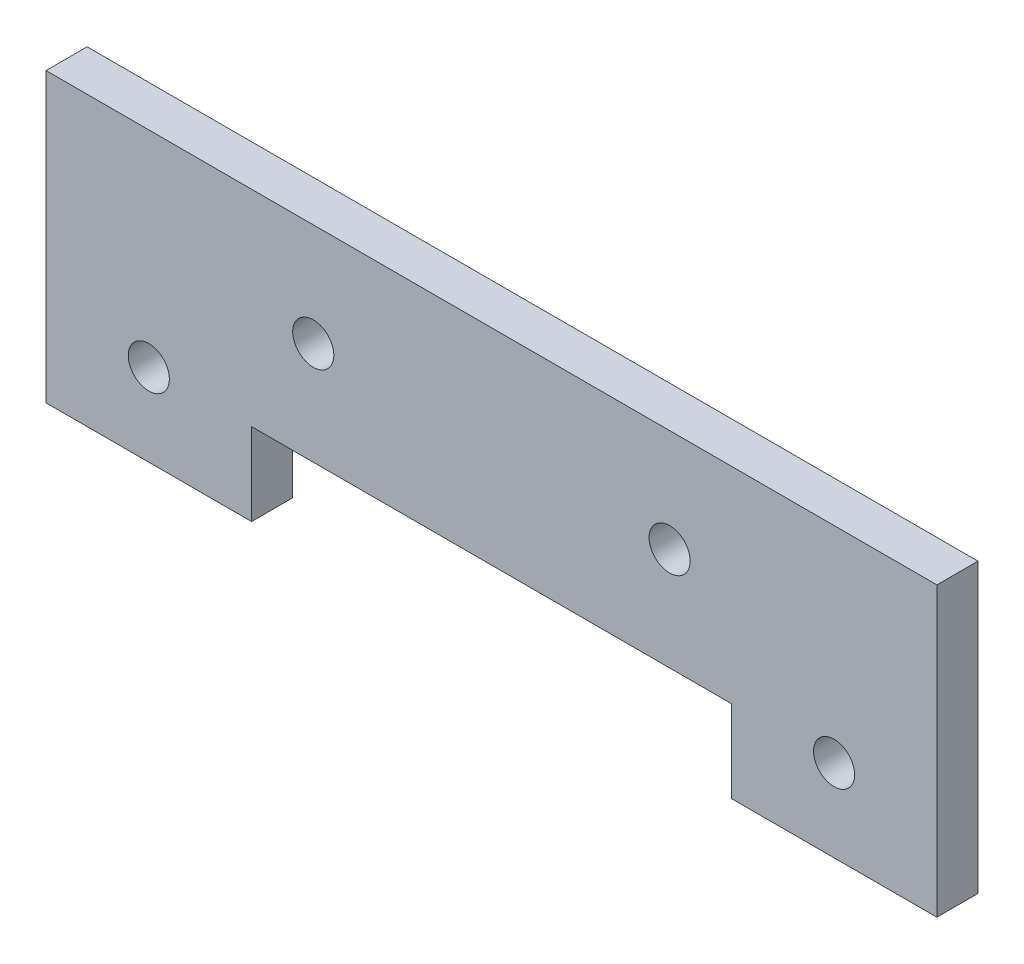
from build123d import *

# Parameters (mm, degrees)
EXTRUDE_1_DEPTH     = 3
SKETCH_2_R          = 1.5
CUT_EXTRUDE_1_DEPTH = 3


with BuildPart() as part:
    # 草图1 → 凸台-拉伸1 (new body)
    with BuildSketch(Plane.XY):
        Polygon((0, 0), (65, 0), (65, -21), (50, -21), (50, -15), (15, -15), (15, -21), (0, -21), align=None)
    extrude(amount=EXTRUDE_1_DEPTH)

    # 草图2 → 切除-拉伸1 (cut)
    with BuildSketch(Plane.XY.offset(3)):
        with Locations((7.5, -15)):
            Circle(SKETCH_2_R)
        with Locations((57.5, -15)):
            Circle(SKETCH_2_R)
        with Locations((19.5, -7.5)):
            Circle(SKETCH_2_R)
        with Locations((45.5, -7.5)):
            Circle(SKETCH_2_R)
    extrude(amount=-CUT_EXTRUDE_1_DEPTH, mode=Mode.SUBTRACT)


solid = part.part
